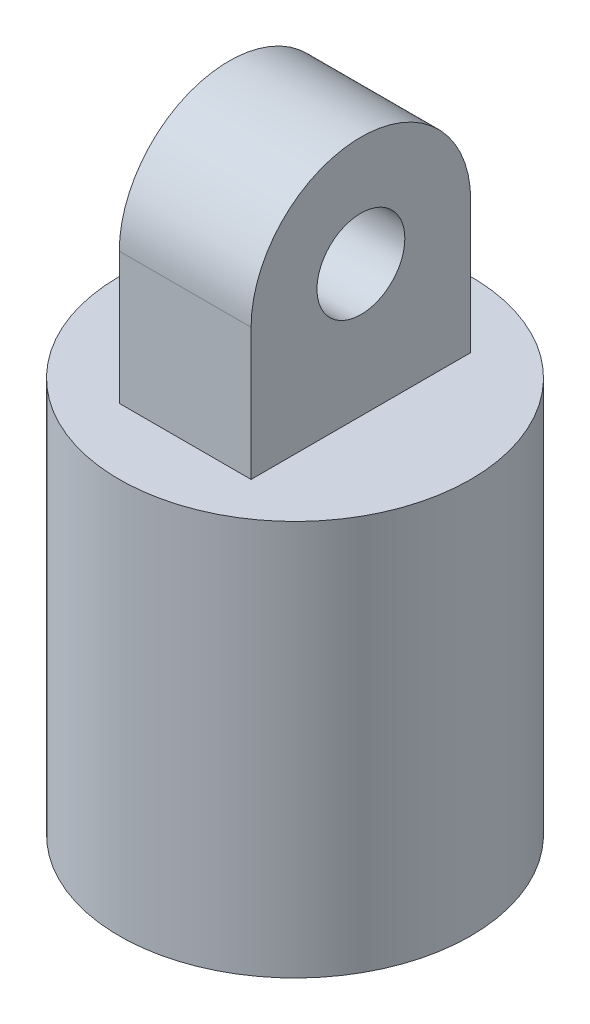
from build123d import *

# Parameters (mm, degrees)
SKETCH2_R           = 10
BOSS_EXTRUDE1_DEPTH = 15


with BuildPart() as part:
    # Sketch1 → Revolve1 (revolve)
    with BuildSketch(Plane.XY, mode=Mode.PRIVATE) as revolve1_sk:
        Polygon((0, 0), (40, 0), (40, -90), (30, -90), (30, -10), (0, -10), align=None)
    revolve(revolve1_sk.sketch.rotate(Axis((0, -10, 0), (0, -1, 0)), 180), axis=Axis((0, -10, 0), (0, -1, 0)))

    # Sketch2 → Boss-Extrude1 (add, symmetric)
    with BuildSketch(Plane(origin=(0, 0, 0), x_dir=(0, 0, -1), z_dir=(1, 0, 0))):
        with BuildLine():
            Line((-25, 30), (-25, 0))
            Line((-25, 0), (25, 0))
            Line((25, 0), (25, 30))
            ThreePointArc((25, 30), (0, 55), (-25, 30))
        make_face()
        with Locations((0, 30)):
            Circle(SKETCH2_R, mode=Mode.SUBTRACT)
    extrude(amount=BOSS_EXTRUDE1_DEPTH, both=True)


solid = part.part
